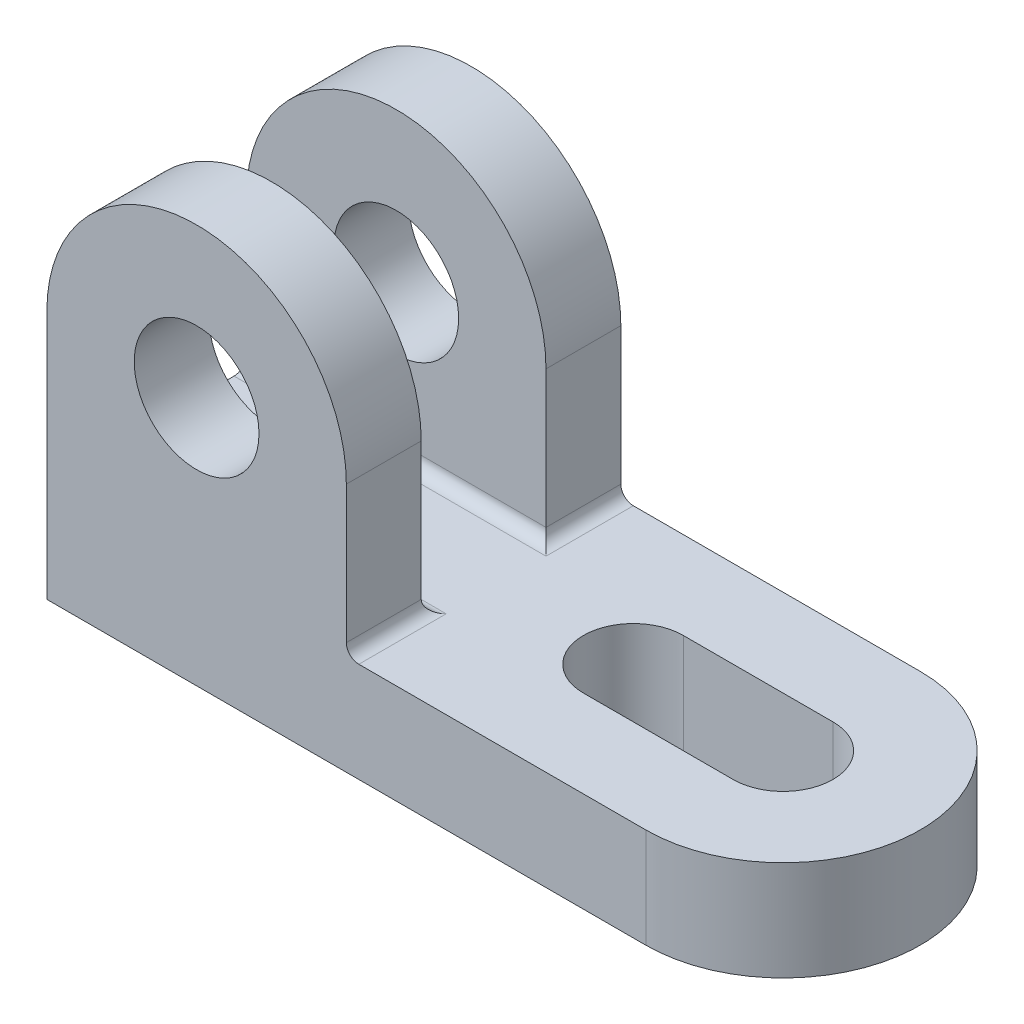
from build123d import *

# Parameters (mm, degrees)
BOSS_EXTRUDE1_DEPTH = 16
CUT_EXTRUDE1_DEPTH  = 65.969223483
BOSS_EXTRUDE2_DEPTH = 12
FILLET1_R           = 2


with BuildPart() as part:
    # Sketch1 → Boss-Extrude1 (new body)
    with BuildSketch(Plane(origin=(0, 0, 0), x_dir=(1, 0, 0), z_dir=(0, 1, 0))):
        with BuildLine():
            Line((-59, 22), (37, 22))
            ThreePointArc((37, 22), (59, 0), (37, -22))
            Line((37, -22), (-59, -22))
            Line((-59, -22), (-59, 22))
        make_face()
    extrude(amount=BOSS_EXTRUDE1_DEPTH)

    # Sketch2 → Cut-Extrude1 (cut, through all)
    with BuildSketch(Plane(origin=(0, 16, 0), x_dir=(1, 0, 0), z_dir=(0, 1, 0))):
        with BuildLine():
            Line((37, -8), (13, -8))
            ThreePointArc((13, -8), (5, 0), (13, 8))
            Line((13, 8), (37, 8))
            ThreePointArc((37, 8), (45, 0), (37, -8))
        make_face()
    extrude(amount=-CUT_EXTRUDE1_DEPTH, mode=Mode.SUBTRACT)

    # Sketch3 → Boss-Extrude2 (add)
    with BuildSketch(Plane.XY.offset(22)):
        with BuildLine():
            ThreePointArc((-11, 40), (-35, 64), (-59, 40))
            Line((-59, 40), (-45, 40))
            ThreePointArc((-45, 40), (-35, 50), (-25, 40))
            Line((-25, 40), (-11, 40))
        make_face()
        with BuildLine():
            Line((-45, 40), (-59, 40))
            ThreePointArc((-59, 40), (-51.970562748, 23.029437252), (-35, 16))
            ThreePointArc((-35, 16), (-18.029437252, 23.029437252), (-11, 40))
            Line((-11, 40), (-25, 40))
            ThreePointArc((-25, 40), (-35, 30), (-45, 40))
        make_face()
        with BuildLine():
            Line((-59, 40), (-59, 16))
            Line((-59, 16), (-35, 16))
            ThreePointArc((-35, 16), (-51.970562748, 23.029437252), (-59, 40))
        make_face()
        with BuildLine():
            Line((-35, 16), (-11, 16))
            Line((-11, 16), (-11, 40))
            ThreePointArc((-11, 40), (-18.029437252, 23.029437252), (-35, 16))
        make_face()
    boss_extrude2 = extrude(amount=-BOSS_EXTRUDE2_DEPTH)

    # Mirror1: Boss-Extrude2 across plane
    add(boss_extrude2.mirror(Plane.XY))

    # Fillet1
    fillet1_edges = [part.edges().sort_by_distance(p)[0] for p in [
        (-11, 16, 16),
        (-35, 16, 10),
        (-35, 16, -10),
        (-11, 16, -16),
    ]]
    fillet(fillet1_edges, radius=FILLET1_R)


solid = part.part
